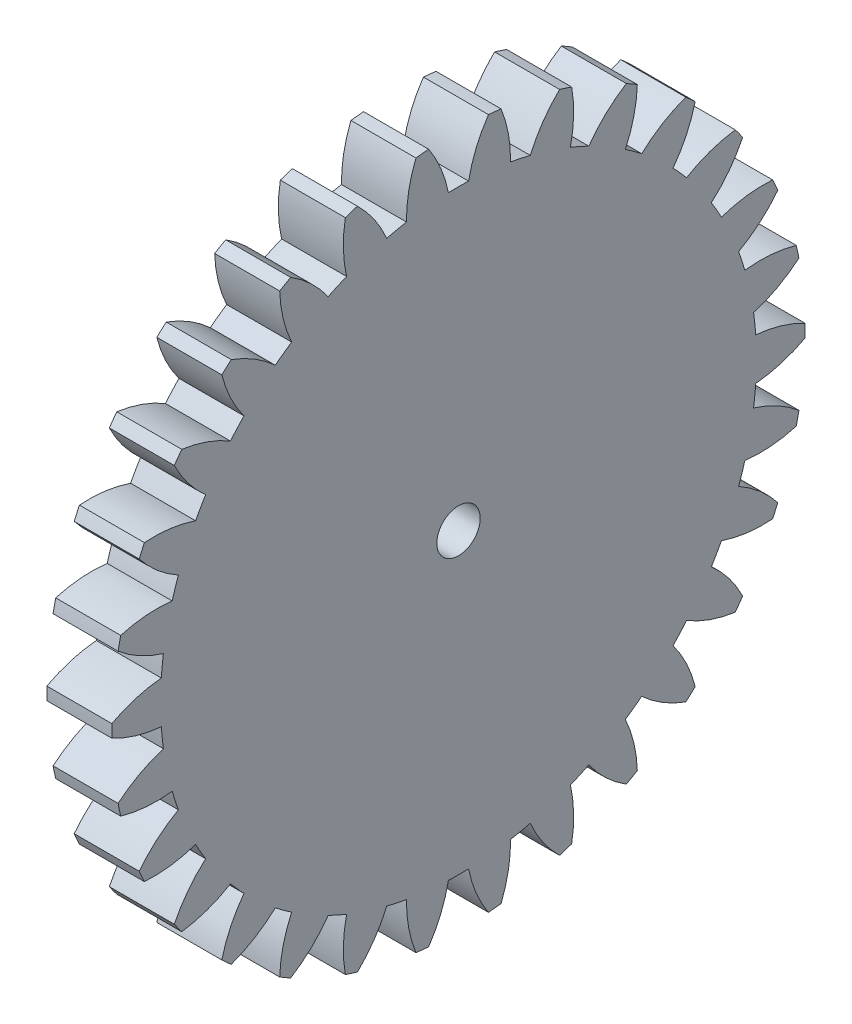
from build123d import *

# Parameters (mm, degrees)
BASPROSKE_W     = 3
BASPROSKE_H     = 16
TOOTHCUT_DEPTH  = 23.825424421
TEETHCUTS_COUNT = 30
TEETHCUTS_ANGLE = 348
BORSKE_R        = 1
BORE_DEPTH      = 50.0000508


with BuildPart() as part:
    # BasProSke → Base-Revolve (revolve)
    with BuildSketch(Plane(origin=(0, 0, 0), x_dir=(1, 0, 0), z_dir=(0, 1, 0)), mode=Mode.PRIVATE) as base_revolve_sk:
        with Locations((1.5, 8)):
            Rectangle(BASPROSKE_W, BASPROSKE_H)
    revolve(base_revolve_sk.sketch.rotate(Axis((-10, 0, 0), (1, 0, 0)), 180), axis=Axis((-10, 0, 0), (1, 0, 0)))

    # TooCutSke → ToothCut (cut, through all)
    with BuildSketch(Plane(origin=(0, 0, 0), x_dir=(0, 0, -1), z_dir=(1, 0, 0))):
        with BuildLine():
            ThreePointArc((0.466400716, 13.741086979), (0, 13.749), (-0.466400716, 13.741086979))
            ThreePointArc((-0.466400716, 13.741086979), (-0.819142092, 14.899954875), (-1.3974676, 15.964351834))
            ThreePointArc((-1.3974676, 15.964351834), (0, 16.0254), (1.3974676, 15.964351834))
            ThreePointArc((1.3974676, 15.964351834), (0.819142092, 14.899954875), (0.466400716, 13.741086979))
        make_face()
    toothcut = extrude(amount=TOOTHCUT_DEPTH, mode=Mode.SUBTRACT)

    # TeethCuts: ToothCut ×30 about axis
    teethcuts_axis = Axis((-10, 0, 0), (1, 0, 0))
    for i in range(1, TEETHCUTS_COUNT):
        add(toothcut.rotate(teethcuts_axis, i * TEETHCUTS_ANGLE / (TEETHCUTS_COUNT - 1)), mode=Mode.SUBTRACT)

    # BorSke → Bore (cut, symmetric)
    with BuildSketch(Plane(origin=(0, 0, 0), x_dir=(0, 0, -1), z_dir=(1, 0, 0))):
        with Locations(Location((0, 0, 0), (0, 0, 180))):
            Circle(BORSKE_R)
    extrude(amount=BORE_DEPTH, both=True, mode=Mode.SUBTRACT)


solid = part.part
